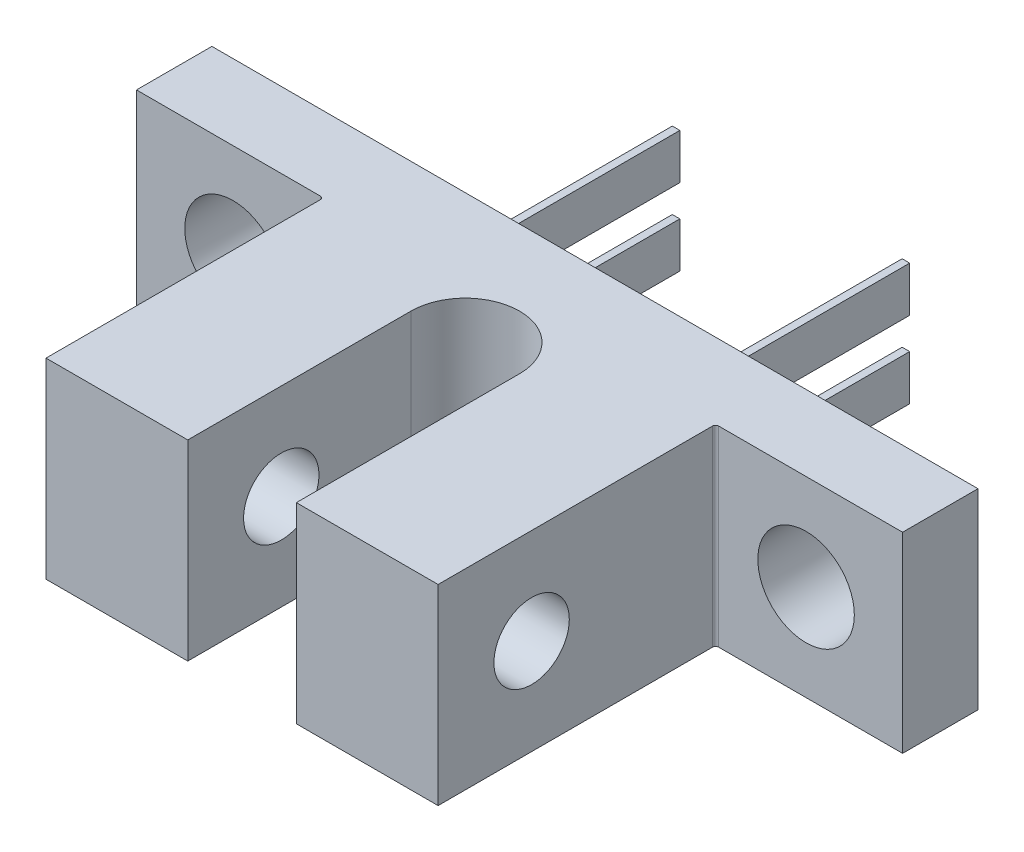
from build123d import *

# Parameters (mm, degrees)
SKETCH1_W           = 25.4
SKETCH1_H           = 11.7
BOSS_EXTRUDE1_DEPTH = 6.35
SKETCH2_W           = 6.2
SKETCH2_H           = 9.2
CUT_EXTRUDE1_DEPTH  = 20.664581181
CUT_EXTRUDE2_DEPTH  = 20.664581181
SKETCH4_W           = 6.2
SKETCH4_H           = 9.2
CUT_EXTRUDE3_DEPTH  = 20.664581181
SKETCH5_W           = 0.25
SKETCH5_H           = 1.5
BOSS_EXTRUDE2_DEPTH = 6.5
SKETCH6_W           = 0.25
SKETCH6_H           = 1.5
BOSS_EXTRUDE3_DEPTH = 6.5
SKETCH7_W           = 0.25
SKETCH7_H           = 1.5
BOSS_EXTRUDE4_DEPTH = 6.5
SKETCH8_W           = 0.25
SKETCH8_H           = 1.5
BOSS_EXTRUDE5_DEPTH = 6.5
HOLE1_D             = 3.2
HOLE1_DEPTH         = 9
HOLE2_D             = 3.2
HOLE2_DEPTH         = 9
HOLE3_D             = 2.5
HOLE3_DEPTH         = 4.7
HOLE4_D             = 2.5
HOLE4_DEPTH         = 19.2
FILLET1_R           = 0.1
FILLET2_R           = 0.1


with BuildPart() as part:
    # Sketch1 → Boss-Extrude1 (new body)
    with BuildSketch(Plane.XZ.offset(1.08911007)):
        with Locations((1.7735363, 5.85)):
            Rectangle(SKETCH1_W, SKETCH1_H)
    extrude(amount=-BOSS_EXTRUDE1_DEPTH)

    # Sketch2 → Cut-Extrude1 (cut, through all)
    with BuildSketch(Plane(origin=(0, 5.26088993, 0), x_dir=(-1, 0, 0), z_dir=(0, 1, 0))):
        with Locations((-11.3735363, 7.1)):
            Rectangle(SKETCH2_W, SKETCH2_H)
    extrude(amount=-CUT_EXTRUDE1_DEPTH, mode=Mode.SUBTRACT)

    # Sketch3 → Cut-Extrude2 (cut, through all)
    with BuildSketch(Plane(origin=(0, 5.26088993, 0), x_dir=(-1, 0, 0), z_dir=(0, 1, 0))):
        with BuildLine():
            Line((-3.5735363, 11.7), (-3.5735363, 4.3))
            ThreePointArc((-3.5735363, 4.3), (-1.7735363, 2.5), (0.0264637, 4.3))
            Line((0.0264637, 4.3), (0.0264637, 11.7))
            Line((0.0264637, 11.7), (-3.5735363, 11.7))
        make_face()
    extrude(amount=-CUT_EXTRUDE2_DEPTH, mode=Mode.SUBTRACT)

    # Sketch4 → Cut-Extrude3 (cut, through all)
    with BuildSketch(Plane(origin=(0, 5.26088993, 0), x_dir=(-1, 0, 0), z_dir=(0, 1, 0))):
        with Locations((7.8264637, 7.1)):
            Rectangle(SKETCH4_W, SKETCH4_H)
    extrude(amount=-CUT_EXTRUDE3_DEPTH, mode=Mode.SUBTRACT)

    # Sketch5 → Boss-Extrude2 (add)
    with BuildSketch(Plane(origin=(0, 0, 0), x_dir=(-1, 0, 0), z_dir=(0, 0, -1))):
        with Locations((2.0364637, 0.81588993)):
            Rectangle(SKETCH5_W, SKETCH5_H)
    extrude(amount=BOSS_EXTRUDE2_DEPTH)

    # Sketch6 → Boss-Extrude3 (add)
    with BuildSketch(Plane(origin=(0, 0, 0), x_dir=(-1, 0, 0), z_dir=(0, 0, -1))):
        with Locations((2.0364637, 3.35588993)):
            Rectangle(SKETCH6_W, SKETCH6_H)
    extrude(amount=BOSS_EXTRUDE3_DEPTH)

    # Sketch7 → Boss-Extrude4 (add)
    with BuildSketch(Plane(origin=(0, 0, 0), x_dir=(-1, 0, 0), z_dir=(0, 0, -1))):
        with Locations((-5.5835363, 3.35588993)):
            Rectangle(SKETCH7_W, SKETCH7_H)
    extrude(amount=BOSS_EXTRUDE4_DEPTH)

    # Sketch8 → Boss-Extrude5 (add)
    with BuildSketch(Plane(origin=(0, 0, 0), x_dir=(-1, 0, 0), z_dir=(0, 0, -1))):
        with Locations((-5.5835363, 0.81588993)):
            Rectangle(SKETCH8_W, SKETCH8_H)
    extrude(amount=BOSS_EXTRUDE5_DEPTH)

    # Hole1
    with Locations(Plane.XY.offset(2.5)):
        with Locations((11.2735363, 2.08588993)):
            Hole(HOLE1_D / 2, depth=HOLE1_DEPTH)

    # Hole2
    with Locations(Plane.XY.offset(2.5)):
        with Locations((-7.7264637, 2.08588993)):
            Hole(HOLE2_D / 2, depth=HOLE2_DEPTH)

    # Hole3
    with Locations(Plane.ZY.offset(4.7264637)):
        with Locations((8.6, 2.08588993)):
            Hole(HOLE3_D / 2, depth=HOLE3_DEPTH)

    # Hole4
    with Locations(Plane(origin=(8.2735363, 0, 0), x_dir=(0, 0, -1), z_dir=(1, 0, 0))):
        with Locations((-8.6, 2.08588993)):
            Hole(HOLE4_D / 2, depth=HOLE4_DEPTH)

    # Fillet1
    fillet1_edges = [part.edges().sort_by_distance(p)[0] for p in [
        (-4.7264637, 2.08588993, 2.5),
    ]]
    fillet(fillet1_edges, radius=FILLET1_R)

    # Fillet2
    fillet2_edges = [part.edges().sort_by_distance(p)[0] for p in [
        (8.2735363, 2.08588993, 2.5),
    ]]
    fillet(fillet2_edges, radius=FILLET2_R)


solid = part.part
